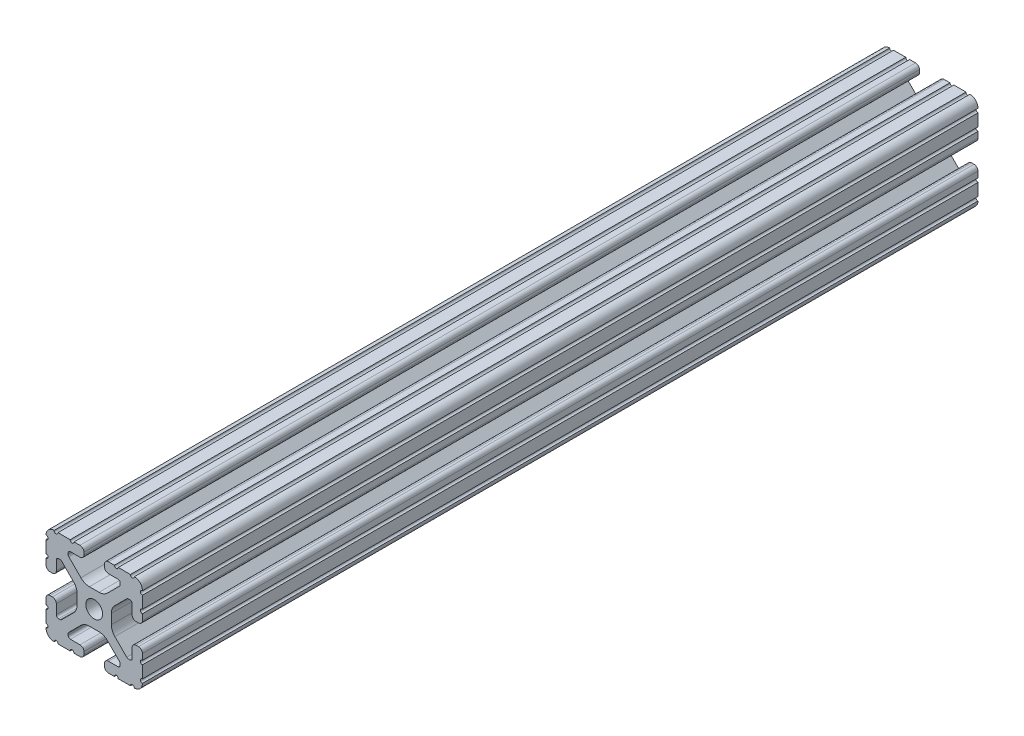
from build123d import *

# Parameters (mm, degrees)
SKETCH1_R      = 3.3274
EXTRUDE1_DEPTH = 330.2


with BuildPart() as part:
    # Sketch1 → Extrude1 (new body)
    with BuildSketch(Plane.XY):
        with BuildLine():
            Line((-10.022898969, 12.91475973), (-5.252158105, 8.144007132))
            ThreePointArc((-5.252158105, 8.144007132), (-3.715177372, 7.117027388), (-1.902183975, 6.7564))
            Line((-1.902183975, 6.7564), (1.902183975, 6.7564))
            ThreePointArc((1.902183975, 6.7564), (3.715177372, 7.117027388), (5.252158105, 8.144007132))
            Line((5.252158105, 8.144007132), (10.022898969, 12.91475973))
            ThreePointArc((10.022898969, 12.91475973), (10.218362387, 13.207291992), (10.287, 13.552357131))
            Line((10.287, 13.552357131), (10.287, 14.0843))
            ThreePointArc((10.287, 14.0843), (10.022898185, 14.721898185), (9.3853, 14.986))
            Line((9.3853, 14.986), (5.617617549, 14.986))
            ThreePointArc((5.617617549, 14.986), (4.519044045, 15.441044045), (4.064, 16.539617549))
            Line((4.064, 16.539617549), (4.064, 17.496382451))
            ThreePointArc((4.064, 17.496382451), (4.519044045, 18.594955955), (5.617617549, 19.05))
            Line((5.617617549, 19.05), (7.974178704, 19.05))
            ThreePointArc((7.974178704, 19.05), (8.736178704, 18.288), (9.498178704, 19.05))
            Line((9.498178704, 19.05), (14.327719207, 19.05))
            ThreePointArc((14.327719207, 19.05), (15.087603123, 18.231251131), (15.847487039, 19.05))
            ThreePointArc((15.847487039, 19.05), (18.120176289, 18.120192083), (19.05, 15.847509295))
            ThreePointArc((19.05, 15.847509295), (18.231250992, 15.08762539), (19.05, 14.327741484))
            Line((19.05, 14.327741484), (19.05, 9.496091471))
            ThreePointArc((19.05, 9.496091471), (18.231250992, 8.736207565), (19.05, 7.97632366))
            Line((19.05, 7.97632366), (19.05, 5.617617549))
            ThreePointArc((19.05, 5.617617549), (18.594955955, 4.519044045), (17.496382451, 4.064))
            Line((17.496382451, 4.064), (16.539617549, 4.064))
            ThreePointArc((16.539617549, 4.064), (15.441044045, 4.519044045), (14.986, 5.617617549))
            Line((14.986, 5.617617549), (14.986, 9.385342516))
            ThreePointArc((14.986, 9.385342516), (14.721898185, 10.022940701), (14.0843, 10.287042516))
            Line((14.0843, 10.287042516), (13.516042086, 10.287042516))
            ThreePointArc((13.516042086, 10.287042516), (13.170975923, 10.218404478), (12.878443117, 10.022939917))
            Line((12.878443117, 10.022939917), (8.14758008, 5.292065243))
            ThreePointArc((8.14758008, 5.292065243), (7.117955879, 3.751120653), (6.7564, 1.933453584))
            Line((6.7564, 1.933453584), (6.7564, -1.933453584))
            ThreePointArc((6.7564, -1.933453584), (7.117955879, -3.751120653), (8.14758008, -5.292065243))
            Line((8.14758008, -5.292065243), (12.878443117, -10.022939917))
            ThreePointArc((12.878443117, -10.022939917), (13.170975923, -10.218404478), (13.516042086, -10.287042516))
            Line((13.516042086, -10.287042516), (14.0843, -10.287042516))
            ThreePointArc((14.0843, -10.287042516), (14.721898185, -10.022940701), (14.986, -9.385342516))
            Line((14.986, -9.385342516), (14.986, -5.617617549))
            ThreePointArc((14.986, -5.617617549), (15.441044045, -4.519044045), (16.539617549, -4.064))
            Line((16.539617549, -4.064), (17.496382451, -4.064))
            ThreePointArc((17.496382451, -4.064), (18.594955955, -4.519044045), (19.05, -5.617617549))
            Line((19.05, -5.617617549), (19.05, -7.976318491))
            ThreePointArc((19.05, -7.976318491), (18.231250992, -8.736202396), (19.05, -9.496086302))
            Line((19.05, -9.496086302), (19.05, -14.32774291))
            ThreePointArc((19.05, -14.32774291), (18.231250992, -15.087626816), (19.05, -15.847510721))
            ThreePointArc((19.05, -15.847510721), (18.120175716, -18.120192644), (15.847486868, -19.05))
            ThreePointArc((15.847486868, -19.05), (15.087602952, -18.231251131), (14.327719036, -19.05))
            Line((14.327719036, -19.05), (9.496062448, -19.05))
            ThreePointArc((9.496062448, -19.05), (8.736178532, -18.231251131), (7.976294616, -19.05))
            Line((7.976294616, -19.05), (5.617617549, -19.05))
            ThreePointArc((5.617617549, -19.05), (4.519044045, -18.594955955), (4.064, -17.496382451))
            Line((4.064, -17.496382451), (4.064, -16.539617549))
            ThreePointArc((4.064, -16.539617549), (4.519044045, -15.441044045), (5.617617549, -14.986))
            Line((5.617617549, -14.986), (9.3853, -14.986))
            ThreePointArc((9.3853, -14.986), (10.022898185, -14.721898185), (10.287, -14.0843))
            Line((10.287, -14.0843), (10.287, -13.552357131))
            ThreePointArc((10.287, -13.552357131), (10.218362387, -13.207291992), (10.022898969, -12.91475973))
            Line((10.022898969, -12.91475973), (5.252158105, -8.144007132))
            ThreePointArc((5.252158105, -8.144007132), (3.715177372, -7.117027388), (1.902183975, -6.7564))
            Line((1.902183975, -6.7564), (-1.902183975, -6.7564))
            ThreePointArc((-1.902183975, -6.7564), (-3.715177372, -7.117027388), (-5.252158105, -8.144007132))
            Line((-5.252158105, -8.144007132), (-10.022898969, -12.91475973))
            ThreePointArc((-10.022898969, -12.91475973), (-10.218362387, -13.207291992), (-10.287, -13.552357131))
            Line((-10.287, -13.552357131), (-10.287, -14.0843))
            ThreePointArc((-10.287, -14.0843), (-10.022898185, -14.721898185), (-9.3853, -14.986))
            Line((-9.3853, -14.986), (-5.617617549, -14.986))
            ThreePointArc((-5.617617549, -14.986), (-4.519044045, -15.441044045), (-4.064, -16.539617549))
            Line((-4.064, -16.539617549), (-4.064, -17.496382451))
            ThreePointArc((-4.064, -17.496382451), (-4.519044045, -18.594955955), (-5.617617549, -19.05))
            Line((-5.617617549, -19.05), (-7.976294616, -19.05))
            ThreePointArc((-7.976294616, -19.05), (-8.736178532, -18.231251131), (-9.496062448, -19.05))
            Line((-9.496062448, -19.05), (-14.327719036, -19.05))
            ThreePointArc((-14.327719036, -19.05), (-15.087602952, -18.231251131), (-15.847486868, -19.05))
            ThreePointArc((-15.847486868, -19.05), (-18.120175716, -18.120192644), (-19.05, -15.847510721))
            ThreePointArc((-19.05, -15.847510721), (-18.231250992, -15.087626816), (-19.05, -14.32774291))
            Line((-19.05, -14.32774291), (-19.05, -9.496086302))
            ThreePointArc((-19.05, -9.496086302), (-18.231250992, -8.736202396), (-19.05, -7.976318491))
            Line((-19.05, -7.976318491), (-19.05, -5.617617549))
            ThreePointArc((-19.05, -5.617617549), (-18.594955955, -4.519044045), (-17.496382451, -4.064))
            Line((-17.496382451, -4.064), (-16.539617549, -4.064))
            ThreePointArc((-16.539617549, -4.064), (-15.441044045, -4.519044045), (-14.986, -5.617617549))
            Line((-14.986, -5.617617549), (-14.986, -9.385342516))
            ThreePointArc((-14.986, -9.385342516), (-14.721898185, -10.022940701), (-14.0843, -10.287042516))
            Line((-14.0843, -10.287042516), (-13.516042086, -10.287042516))
            ThreePointArc((-13.516042086, -10.287042516), (-13.170975923, -10.218404478), (-12.878443117, -10.022939917))
            Line((-12.878443117, -10.022939917), (-8.14758008, -5.292065243))
            ThreePointArc((-8.14758008, -5.292065243), (-7.117955879, -3.751120653), (-6.7564, -1.933453584))
            Line((-6.7564, -1.933453584), (-6.7564, 1.933453584))
            ThreePointArc((-6.7564, 1.933453584), (-7.117955879, 3.751120653), (-8.14758008, 5.292065243))
            Line((-8.14758008, 5.292065243), (-12.878443117, 10.022939917))
            ThreePointArc((-12.878443117, 10.022939917), (-13.170975923, 10.218404478), (-13.516042086, 10.287042516))
            Line((-13.516042086, 10.287042516), (-14.0843, 10.287042516))
            ThreePointArc((-14.0843, 10.287042516), (-14.721898185, 10.022940701), (-14.986, 9.385342516))
            Line((-14.986, 9.385342516), (-14.986, 5.617617549))
            ThreePointArc((-14.986, 5.617617549), (-15.441044045, 4.519044045), (-16.539617549, 4.064))
            Line((-16.539617549, 4.064), (-17.496382451, 4.064))
            ThreePointArc((-17.496382451, 4.064), (-18.594955955, 4.519044045), (-19.05, 5.617617549))
            Line((-19.05, 5.617617549), (-19.05, 7.97632366))
            ThreePointArc((-19.05, 7.97632366), (-18.231250992, 8.736207565), (-19.05, 9.496091471))
            Line((-19.05, 9.496091471), (-19.05, 14.327741484))
            ThreePointArc((-19.05, 14.327741484), (-18.231250992, 15.08762539), (-19.05, 15.847509295))
            ThreePointArc((-19.05, 15.847509295), (-18.120176289, 18.120192083), (-15.847487039, 19.05))
            ThreePointArc((-15.847487039, 19.05), (-15.087603123, 18.231251131), (-14.327719207, 19.05))
            Line((-14.327719207, 19.05), (-9.498178704, 19.05))
            ThreePointArc((-9.498178704, 19.05), (-8.736178704, 18.288), (-7.974178704, 19.05))
            Line((-7.974178704, 19.05), (-5.617617549, 19.05))
            ThreePointArc((-5.617617549, 19.05), (-4.519044045, 18.594955955), (-4.064, 17.496382451))
            Line((-4.064, 17.496382451), (-4.064, 16.539617549))
            ThreePointArc((-4.064, 16.539617549), (-4.519044045, 15.441044045), (-5.617617549, 14.986))
            Line((-5.617617549, 14.986), (-9.3853, 14.986))
            ThreePointArc((-9.3853, 14.986), (-10.022898185, 14.721898185), (-10.287, 14.0843))
            Line((-10.287, 14.0843), (-10.287, 13.552357131))
            ThreePointArc((-10.287, 13.552357131), (-10.218362387, 13.207291992), (-10.022898969, 12.91475973))
        make_face()
        Circle(SKETCH1_R, mode=Mode.SUBTRACT)
    extrude(amount=-EXTRUDE1_DEPTH)


solid = part.part
